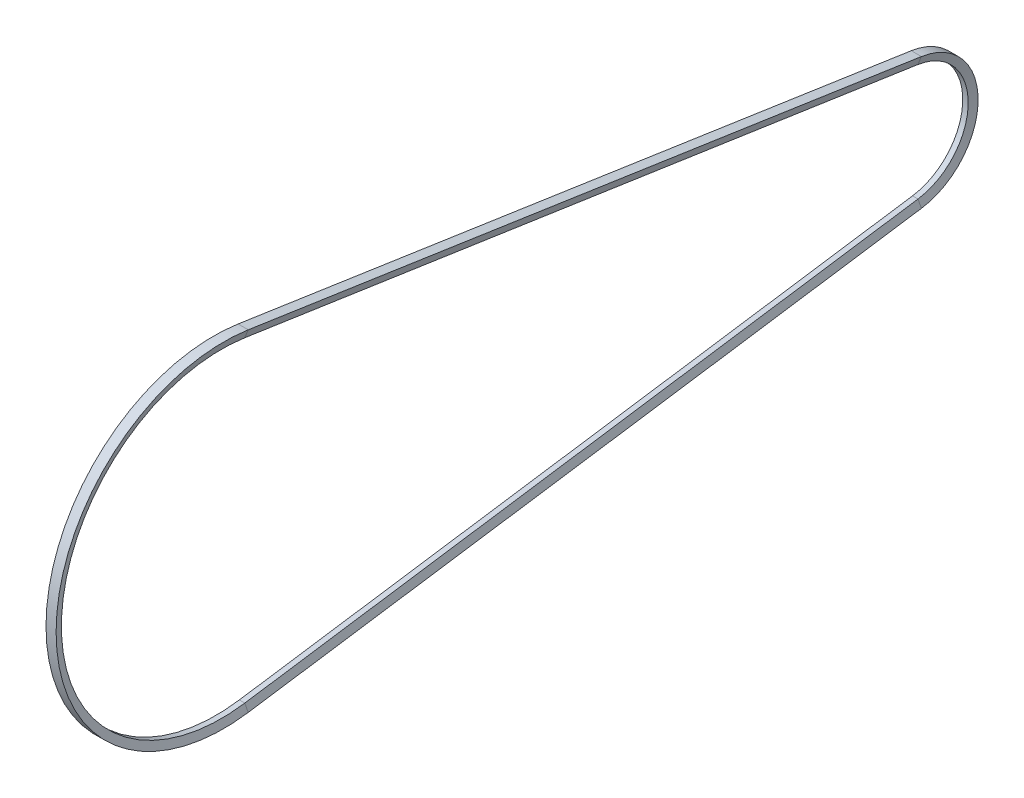
from build123d import *


with BuildPart() as part:
    # 扫描1: sweep along a path in 草图1
    with BuildLine(Plane(origin=(0, 0, 0), x_dir=(0, 0, -1), z_dir=(1, 0, 0))) as sweep_1_path:
        Line((46.258724233, 311.584868747), (1312.1666366, 123.644789185))
        ThreePointArc((1312.1666366, 123.644789185), (1418.81, 0), (1312.1666366, -123.644789185))
        Line((1312.1666366, -123.644789185), (46.258724233, -311.584868747))
        ThreePointArc((46.258724233, -311.584868747), (-315, 0), (46.258724233, 311.584868747))
    # 草图2 → 扫描1 (sweep)
    with BuildSketch(Plane.XY):
        Polygon((-9.5, 315), (9.5, 315), (5.128051255, 300.7), (-5.128051255, 300.7), align=None)
    sweep(path=sweep_1_path.line)


solid = part.part
